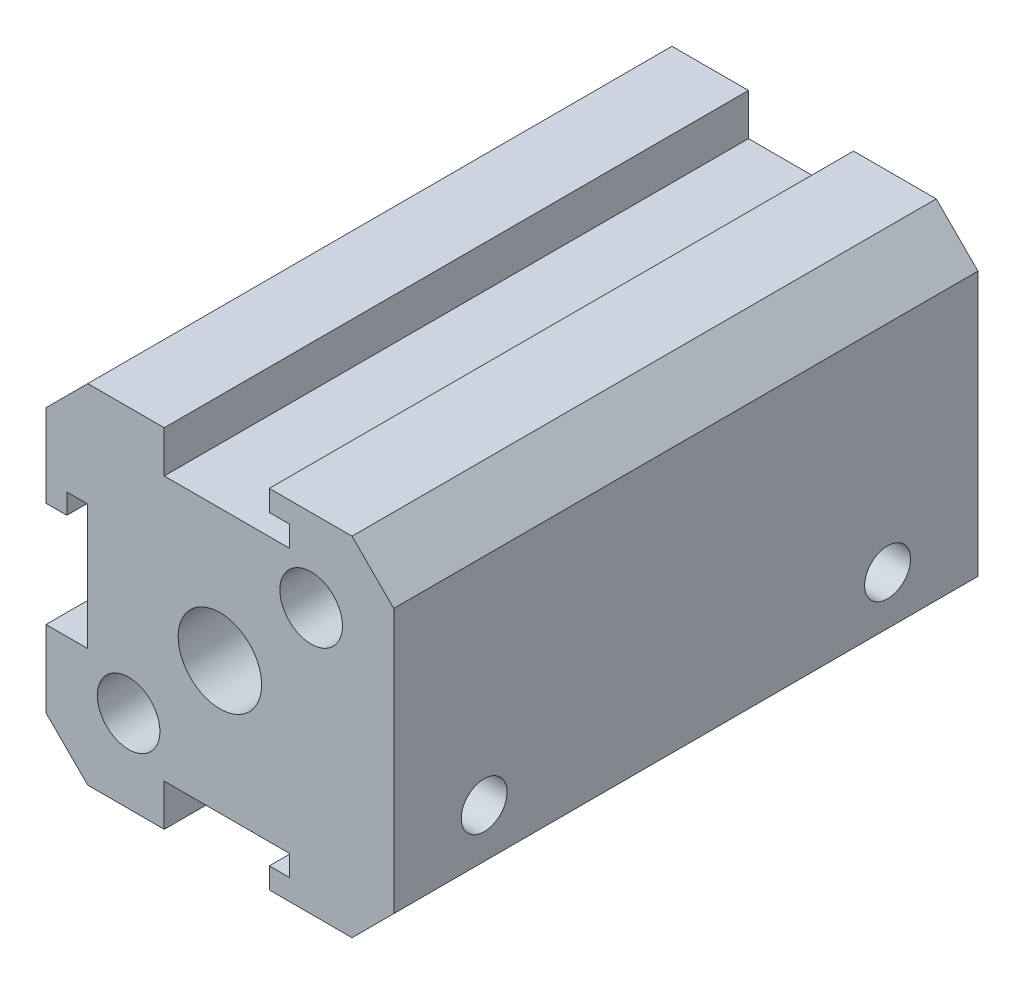
from build123d import *

# Parameters (mm, degrees)
SKETCH1_R                       = 3
BOSS_EXTRUDE1_DEPTH             = 42
M4_CLEARANCE_HOLE1_D            = 4.5
TAP_DRILL_FOR_M4X0_7_TAP1_D     = 3.3
TAP_DRILL_FOR_M4X0_7_TAP1_DEPTH = 5.08
TAP_DRILL_FOR_M4X0_7_TAP1_TIP   = 0.991420021


with BuildPart() as part:
    # Sketch1 → Boss-Extrude1 (new body)
    with BuildSketch(Plane.XY):
        Polygon((-12.5, -9.5), (-9.5, -12.5), (-4, -12.5), (-4, -9.5), (5, -9.5), (5, -11), (3.55, -11), (3.55, -12.5), (9.5, -12.5), (12.5, -9.5), (12.5, 9.5), (9.5, 12.5), (3.55, 12.5), (3.55, 11), (5, 11), (5, 9.5), (-4, 9.5), (-4, 12.5), (-9.5, 12.5), (-12.5, 9.5), (-12.5, 3.55), (-11, 3.55), (-11, 5), (-9.5, 5), (-9.5, -4), (-12.5, -4), align=None)
        with Locations(Location((0, 0, 0), (0, 0, 180))):
            Circle(SKETCH1_R, mode=Mode.SUBTRACT)
    extrude(amount=BOSS_EXTRUDE1_DEPTH)

    # M4 Clearance Hole1 (through all)
    with Locations(Plane.XY.offset(42)):
        with Locations((6.560660172, 6.560660172), (-6.560660172, -6.560660172)):
            Hole(M4_CLEARANCE_HOLE1_D / 2)

    # Tap Drill for M4x0.7 Tap1
    with Locations(Plane(origin=(12.5, 0, 0), x_dir=(0, 0, -1), z_dir=(1, 0, 0))):
        with Locations((-35.5, -6), (-6.5, -6)):
            Hole(TAP_DRILL_FOR_M4X0_7_TAP1_D / 2, depth=TAP_DRILL_FOR_M4X0_7_TAP1_DEPTH)
            with Locations((0, 0, -(TAP_DRILL_FOR_M4X0_7_TAP1_DEPTH + TAP_DRILL_FOR_M4X0_7_TAP1_TIP / 2))):  # 118° drill point
                Cone(0, TAP_DRILL_FOR_M4X0_7_TAP1_D / 2, TAP_DRILL_FOR_M4X0_7_TAP1_TIP, mode=Mode.SUBTRACT)


solid = part.part
